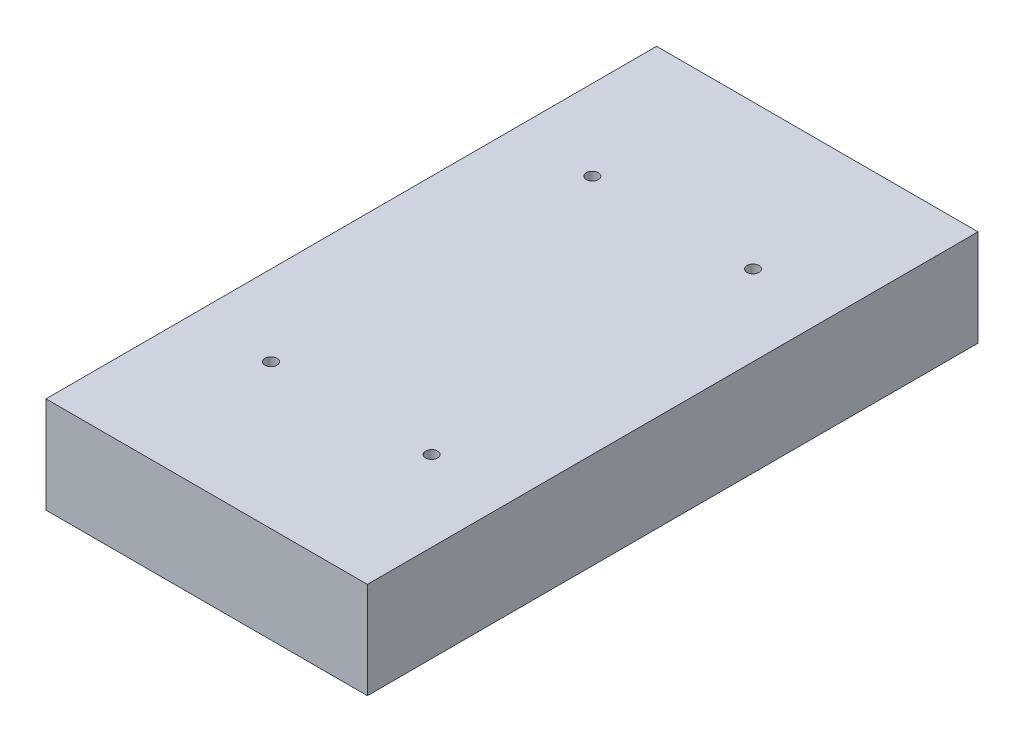
from build123d import *

# Parameters (mm, degrees)
SKETCH1_W           = 508
SKETCH1_H           = 965.2
BOSS_EXTRUDE1_DEPTH = 152.4
SKETCH2_R           = 9.525
CUT_EXTRUDE1_DEPTH  = 127


with BuildPart() as part:
    # Sketch1 → Boss-Extrude1 (new body)
    with BuildSketch(Plane(origin=(0, 0, 0), x_dir=(1, 0, 0), z_dir=(0, 1, 0))):
        Rectangle(SKETCH1_W, SKETCH1_H)
    extrude(amount=BOSS_EXTRUDE1_DEPTH)

    # Sketch2 → Cut-Extrude1 (cut)
    with BuildSketch(Plane(origin=(0, 152.4, 0), x_dir=(1, 0, 0), z_dir=(0, 1, 0))):
        with Locations(Location((127, 254, 0), (0, 0, 270))):
            Circle(SKETCH2_R)
        with Locations(Location((-127, 254, 0), (0, 0, 90))):
            Circle(SKETCH2_R)
        with Locations(Location((127, -254, 0), (0, 0, 90))):
            Circle(SKETCH2_R)
        with Locations(Location((-127, -254, 0), (0, 0, 270))):
            Circle(SKETCH2_R)
    extrude(amount=-CUT_EXTRUDE1_DEPTH, mode=Mode.SUBTRACT)


solid = part.part
